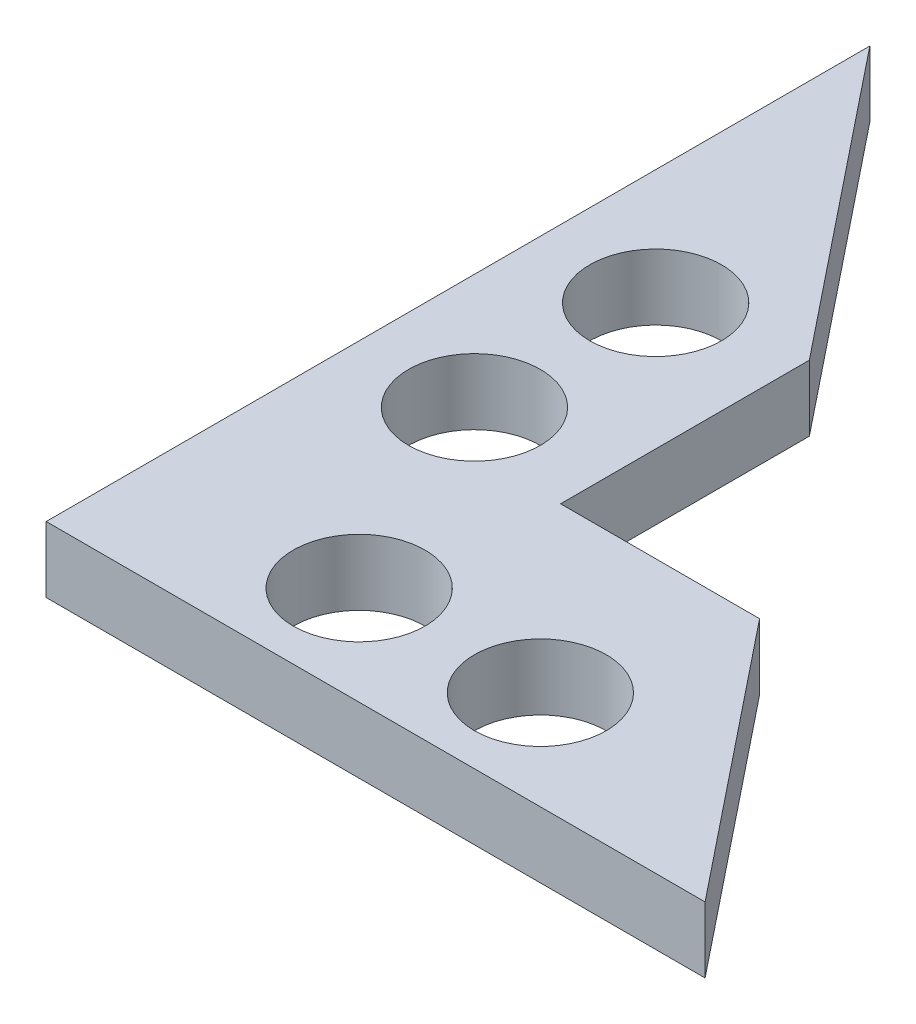
from build123d import *

# Parameters (mm, degrees)
BOSS_EXTRUDE1_DEPTH = 5.08
SKETCH2_R           = 5.08
CUT_EXTRUDE1_DEPTH  = 7.62
CUT_EXTRUDE2_DEPTH  = 7.62


with BuildPart() as part:
    # Sketch1 → Boss-Extrude1 (new body)
    with BuildSketch(Plane(origin=(0, 0, 0), x_dir=(1, 0, 0), z_dir=(0, 1, 0))):
        Polygon((0, 0), (0, 63.5), (50.8, 0), align=None)
    extrude(amount=BOSS_EXTRUDE1_DEPTH)

    # Sketch2 → Cut-Extrude1 (cut)
    with BuildSketch(Plane(origin=(0, 5.08, 0), x_dir=(1, 0, 0), z_dir=(0, 1, 0))):
        with Locations(Location((8.89, 24.13, 0), (0, 0, 270))):
            Circle(SKETCH2_R)
        with Locations(Location((8.89, 38.1, 0), (0, 0, 270))):
            Circle(SKETCH2_R)
        with Locations(Location((16.51, 7.62, 0), (0, 0, 270))):
            Circle(SKETCH2_R)
        with Locations(Location((30.48, 7.62, 0), (0, 0, 270))):
            Circle(SKETCH2_R)
    extrude(amount=-CUT_EXTRUDE1_DEPTH, mode=Mode.SUBTRACT)

    # Sketch3 → Cut-Extrude2 (cut)
    with BuildSketch(Plane(origin=(0, 5.08, 0), x_dir=(1, 0, 0), z_dir=(0, 1, 0))):
        Polygon((18.646117634, 21.012186882), (18.646117634, 40.192352958), (33.990250495, 21.012186882), align=None)
    extrude(amount=-CUT_EXTRUDE2_DEPTH, mode=Mode.SUBTRACT)


solid = part.part
